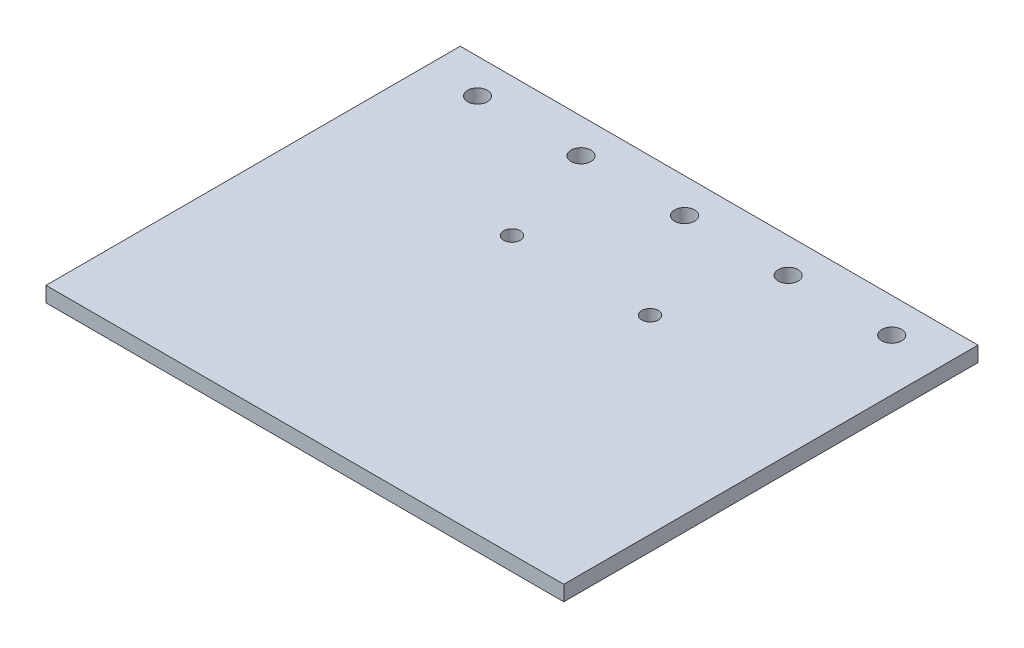
from build123d import *

# Parameters (mm, degrees)
SKETCH1_W           = 95.25
SKETCH1_H           = 76.2
BOSS_EXTRUDE1_DEPTH = 2.794
SKETCH2_R           = 1.8288
CUT_EXTRUDE1_DEPTH  = 62.053722745
SKETCH3_R           = 1.524
CUT_EXTRUDE2_DEPTH  = 62.053722745


with BuildPart() as part:
    # Sketch1 → Boss-Extrude1 (new body)
    with BuildSketch(Plane(origin=(0, 0, 0), x_dir=(1, 0, 0), z_dir=(0, 1, 0))):
        Rectangle(SKETCH1_W, SKETCH1_H)
    extrude(amount=BOSS_EXTRUDE1_DEPTH)

    # Sketch2 → Cut-Extrude1 (cut, through all)
    with BuildSketch(Plane(origin=(0, 2.794, 0), x_dir=(1, 0, 0), z_dir=(0, 1, 0))):
        with Locations(Location((-38.1, 31.75, 0), (0, 0, 270))):
            Circle(SKETCH2_R)
        with Locations(Location((-19.05, 31.75, 0), (0, 0, 270))):
            Circle(SKETCH2_R)
        with Locations(Location((0, 31.75, 0), (0, 0, 270))):
            Circle(SKETCH2_R)
        with Locations(Location((19.05, 31.75, 0), (0, 0, 270))):
            Circle(SKETCH2_R)
        with Locations(Location((38.1, 31.75, 0), (0, 0, 270))):
            Circle(SKETCH2_R)
    extrude(amount=-CUT_EXTRUDE1_DEPTH, mode=Mode.SUBTRACT)

    # Sketch3 → Cut-Extrude2 (cut, through all)
    with BuildSketch(Plane(origin=(0, 2.794, 0), x_dir=(1, 0, 0), z_dir=(0, 1, 0))):
        with Locations(Location((-12.7, 12.7, 0), (0, 0, 270))):
            Circle(SKETCH3_R)
        with Locations(Location((12.7, 12.7, 0), (0, 0, 270))):
            Circle(SKETCH3_R)
    extrude(amount=-CUT_EXTRUDE2_DEPTH, mode=Mode.SUBTRACT)


solid = part.part
